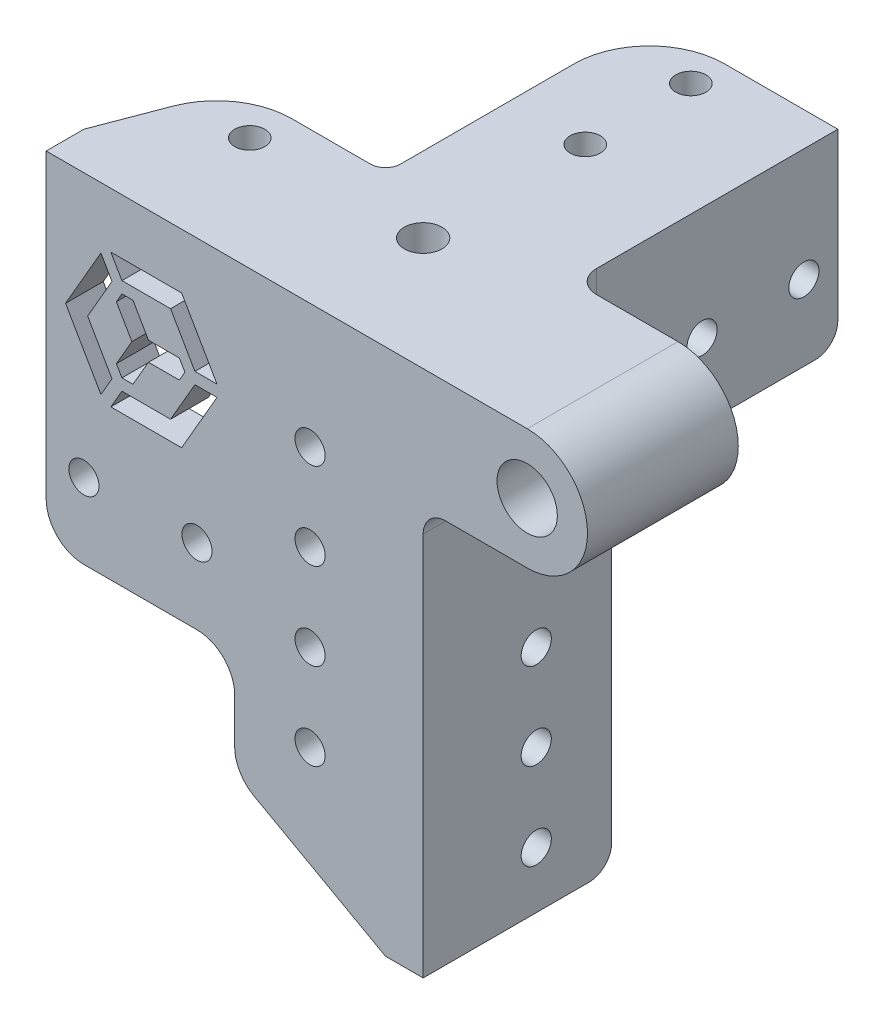
from build123d import *
from build123d.topology import SkipClean

# Parameters (mm, degrees)
SKETCH1_R               = 8
SKETCH1_R_2             = 4
SKETCH1_W               = 5
SKETCH1_H               = 65
SKETCH1_W_2             = 25
SKETCH1_H_2             = 20
BOSS_EXTRUDE2_DEPTH     = 5
SKETCH3_W               = 30
SKETCH3_H               = 20
SKETCH3_H_2             = 5
BOSS_EXTRUDE3_DEPTH     = 5
SKETCH4_W               = 26
SKETCH4_H               = 50
BOSS_EXTRUDE4_DEPTH     = 5
BOSS_EXTRUDE5_START     = 15
SKETCH5_R               = 4
BOSS_EXTRUDE5_DEPTH     = 15
CUT_EXTRUDE1_DEPTH      = 98.929770754
CUT_EXTRUDE1_DEPTH_BACK = 98.929770754
SKETCH6_R               = 2.5
SKETCH6_R_2             = 2
SKETCH7_R               = 2
CUT_EXTRUDE2_DEPTH      = 15
SKETCH9_R               = 2
CUT_EXTRUDE3_DEPTH      = 86.089599835
FILLET1_R               = 3
CUT_EXTRUDE4_DEPTH      = 10
FILLET2_R               = 10
FILLET3_R               = 2
CUT_EXTRUDE6_DEPTH      = 81.932070281
CUT_EXTRUDE6_DEPTH_BACK = 10
FILLET4_R               = 3
CUT_EXTRUDE8_DEPTH      = 82.946567957
FILLET5_R               = 5
CUT_EXTRUDE5_DEPTH      = 10


with BuildPart() as part:
    # Sketch1 → Boss-Extrude2 (new body)
    # profile 1 of 8: a face of its own
    with BuildSketch(Plane.XY):
        with Locations((38.8, 17)):
            Circle(SKETCH1_R)
        with Locations((38.8, 17)):
            Circle(SKETCH1_R_2, mode=Mode.SUBTRACT)
    # profile 2 of 8: a face of its own
    with BuildSketch(Plane.XY):
        with BuildLine():
            Line((25, 25), (25, 20))
            Line((25, 20), (25, 9))
            Line((25, 9), (38.8, 9))
            ThreePointArc((38.8, 9), (30.8, 17), (38.8, 25))
            Line((38.8, 25), (25, 25))
        make_face()
    # profile 3 of 8: a face of its own
    with BuildSketch(Plane.XY):
        with Locations((22.5, -12.5)):
            Rectangle(SKETCH1_W, SKETCH1_H)
    # profile 4 of 8: a face of its own
    with BuildSketch(Plane.XY):
        Polygon((20, 20), (25, 20), (25, 25), (-25, 25), (-25, 20), (0, 20), align=None)
    # profile 5 of 8: a face of its own
    with BuildSketch(Plane.XY):
        Polygon((20, 20), (0, 20), (0, 0), (0, -20), (0, -33.888888889), (20, -45), align=None)
    # profile 6 of 8: a face of its own
    with BuildSketch(Plane.XY):
        with Locations((-12.5, 10)):
            Rectangle(SKETCH1_W_2, SKETCH1_H_2)
    # profile 7 of 8: a face of its own
    with BuildSketch(Plane.XY):
        with Locations((-12.5, -10)):
            Rectangle(SKETCH1_W_2, SKETCH1_H_2)
    # profile 8 of 8: a face of its own
    with BuildSketch(Plane.XY):
        Polygon((0, -33.888888889), (0, -20), (-25, -20), align=None)
    extrude(amount=BOSS_EXTRUDE2_DEPTH)

    # Sketch3 → Boss-Extrude3 (add)
    with BuildSketch(Plane(origin=(25, 0, 0), x_dir=(0, 0, -1), z_dir=(1, 0, 0))):
        Polygon((20, 0), (20, -45), (50, 0), align=None)
        with Locations((35, 10)):
            Rectangle(SKETCH3_W, SKETCH3_H)
        Polygon((0, 9), (0, -45), (20, -45), (20, 0), (20, 20), (20, 25), (0, 25), align=None)
        with Locations((35, 22.5)):
            Rectangle(SKETCH3_W, SKETCH3_H_2)
    extrude(amount=-BOSS_EXTRUDE3_DEPTH)

    # Sketch4 → Boss-Extrude4 (add)
    with BuildSketch(Plane(origin=(0, 25, 0), x_dir=(1, 0, 0), z_dir=(0, 1, 0))):
        with Locations((7, 25)):
            Rectangle(SKETCH4_W, SKETCH4_H)
        Polygon((-25, 0), (-6, 0), (-6, 50), align=None)
    extrude(amount=-BOSS_EXTRUDE4_DEPTH)

    # Sketch5 → Boss-Extrude5 (add)
    with SkipClean():  # the faces are left unmerged after this step: merging them gives an invalid solid
        with BuildSketch(Plane(origin=(0, 0, 0), x_dir=(-1, 0, 0), z_dir=(0, 0, -1)).offset(BOSS_EXTRUDE5_START)):
            with BuildLine():
                Line((-38.8, 9), (-25, 9))
                Line((-25, 9), (-25, 25))
                Line((-25, 25), (-38.8, 25))
                ThreePointArc((-38.8, 25), (-46.8, 17), (-38.8, 9))
            make_face()
            with Locations((-38.8, 17)):
                Circle(SKETCH5_R, mode=Mode.SUBTRACT)
        extrude(amount=-BOSS_EXTRUDE5_DEPTH)

    # Sketch6 → Cut-Extrude1 (cut, two sides: drawn at the far end of the back side and taken through both)
    with SkipClean():  # the faces are left unmerged after this step: merging them gives an invalid solid
        with BuildSketch(Plane(origin=(0, 25, 0), x_dir=(1, 0, 0), z_dir=(0, 1, 0)).offset(-CUT_EXTRUDE1_DEPTH_BACK)):
            with Locations(Location((10, 10, 0), (0, 0, 180))):
                Circle(SKETCH6_R)
            with Locations(Location((10, 45.5, 0), (0, 0, 180))):
                Circle(SKETCH6_R_2)
            with Locations(Location((10, 31.5, 0), (0, 0, 180))):
                Circle(SKETCH6_R_2)
            with Locations(Location((-13, 10, 0), (0, 0, 180))):
                Circle(SKETCH6_R_2)
        extrude(amount=CUT_EXTRUDE1_DEPTH + CUT_EXTRUDE1_DEPTH_BACK, mode=Mode.SUBTRACT)

    # Sketch7 → Cut-Extrude2 (cut)
    with SkipClean():  # the faces are left unmerged after this step: merging them gives an invalid solid
        with BuildSketch(Plane(origin=(25, 0, 0), x_dir=(0, 0, -1), z_dir=(1, 0, 0))):
            with Locations(Location((10, -37.5, 0), (0, 0, 90))):
                Circle(SKETCH7_R)
            with Locations(Location((10, -26, 0), (0, 0, 90))):
                Circle(SKETCH7_R)
            with Locations(Location((10, -14.5, 0), (0, 0, 90))):
                Circle(SKETCH7_R)
            with Locations(Location((10, -3, 0), (0, 0, 90))):
                Circle(SKETCH7_R)
            with Locations(Location((45.5, 10, 0), (0, 0, 90))):
                Circle(SKETCH7_R)
            with Locations(Location((32, 10, 0), (0, 0, 90))):
                Circle(SKETCH7_R)
        extrude(amount=-CUT_EXTRUDE2_DEPTH, mode=Mode.SUBTRACT)

    # Sketch9 → Cut-Extrude3 (cut, through all)
    with SkipClean():  # the faces are left unmerged after this step: merging them gives an invalid solid
        with BuildSketch(Plane.XY.offset(5)):
            with Locations((10, -26)):
                Circle(SKETCH9_R)
            with Locations((10, -14.5)):
                Circle(SKETCH9_R)
            with Locations((10, -3)):
                Circle(SKETCH9_R)
            with Locations((10, 8.5)):
                Circle(SKETCH9_R)
            with Locations((-20, -10)):
                Circle(SKETCH9_R)
            with Locations((-5, -10)):
                Circle(SKETCH9_R)
        extrude(amount=-CUT_EXTRUDE3_DEPTH, mode=Mode.SUBTRACT)

    # Fillet1
    fillet1_edges = [part.edges().sort_by_distance(p)[0] for p in [
        (25, 9, -7.5),
        (25, 17, -15),
    ]]
    fillet(fillet1_edges, radius=FILLET1_R)

    # Sketch10 → Cut-Extrude4 (cut)
    with SkipClean():  # the faces are left unmerged after this step: merging them gives an invalid solid
        with BuildSketch(Plane(origin=(0, 25, 0), x_dir=(1, 0, 0), z_dir=(0, 1, 0))):
            Polygon((0, 50), (0, 15), (-19.3, 15), (-6, 50), align=None)
        extrude(amount=-CUT_EXTRUDE4_DEPTH, mode=Mode.SUBTRACT)

    # Fillet2
    fillet2_edges = [part.edges().sort_by_distance(p)[0] for p in [
        (0, 22.5, -50),
        (-19.3, 22.5, -15),
    ]]
    fillet(fillet2_edges, radius=FILLET2_R)

    # Fillet3
    fillet3_edges = [part.edges().sort_by_distance(p)[0] for p in [
        (0, 22.5, -15),
    ]]
    fillet(fillet3_edges, radius=FILLET3_R)

    # Sketch12 → Cut-Extrude6 (cut, two sides: drawn at the far end of the back side and taken through both)
    with SkipClean():  # the faces are left unmerged after this step: merging them gives an invalid solid
        with BuildSketch(Plane.ZY.offset(-20).offset(-CUT_EXTRUDE6_DEPTH_BACK)):
            Polygon((-212.315462117, 0), (-50, 0), (-20, 0), (-20, -45), (-20, -207.315462117), (-257.997163138, -428.092696695), (-450.312625255, -220.777234578), align=None)
        extrude(amount=CUT_EXTRUDE6_DEPTH + CUT_EXTRUDE6_DEPTH_BACK, mode=Mode.SUBTRACT)

    # Fillet4
    fillet4_edges = [part.edges().sort_by_distance(p)[0] for p in [
        (22.5, 0, -20),
        (22.5, 0, -50),
        (22.5, -45, -20),
    ]]
    fillet(fillet4_edges, radius=FILLET4_R)

    # Sketch13 → Cut-Extrude8 (cut, through all)
    with SkipClean():  # the faces are left unmerged after this step: merging them gives an invalid solid
        with BuildSketch(Plane(origin=(0, 0, 0), x_dir=(-1, 0, 0), z_dir=(0, 0, -1))):
            Polygon((0, -213.361482543), (0, -33.888888889), (0, -20), (25, -20), (204.472593655, -20), (451.100266521, -280.799613629), (246.627672866, -474.161096172), align=None)
        extrude(amount=-CUT_EXTRUDE8_DEPTH, mode=Mode.SUBTRACT)

    # Fillet5
    fillet5_edges = [part.edges().sort_by_distance(p)[0] for p in [
        (-25, -20, 2.5),
        (0, -33.888888889, 2.5),
        (0, -20, 2.5),
    ]]
    fillet(fillet5_edges, radius=FILLET5_R)

    # Sketch11 → Cut-Extrude5 (cut)
    with SkipClean():  # the faces are left unmerged after this step: merging them gives an invalid solid
        with BuildSketch(Plane(origin=(0, 0, 0), x_dir=(-1, 0, 0), z_dir=(0, 0, -1))):
            Polygon((7.036476303, -0.107659764), (16.421882278, -0.107659764), (14.955412595, 2.432340236), (8.502945986, 2.432340236), (5.276712682, 8.020340236), (2.343773315, 8.020340236), align=None)
            Polygon((14.955412595, 15.132340236), (16.421882278, 17.672340236), (7.036476303, 17.672340236), (2.343773315, 9.544340236), (5.276712682, 9.544340236), (8.502945986, 15.132340236), align=None)
            Polygon((17.741704994, 0.654340236), (22.434407982, 8.782340236), (17.741704994, 16.910340236), (16.27523531, 14.370340236), (19.501468614, 8.782340236), (16.27523531, 3.194340236), align=None)
            Polygon((15.688647437, 5.226340236), (14.955412595, 3.956340236), (13.488942911, 3.956340236), (11.435885354, 7.512340236), (7.329770239, 7.512340236), (6.596535397, 8.782340236), (7.329770239, 10.052340236), (11.435885354, 10.052340236), (13.488942911, 13.608340236), (14.955412595, 13.608340236), (15.688647437, 12.338340236), (13.635589879, 8.782340236), align=None)
        extrude(amount=-CUT_EXTRUDE5_DEPTH, mode=Mode.SUBTRACT)


solid = part.part
